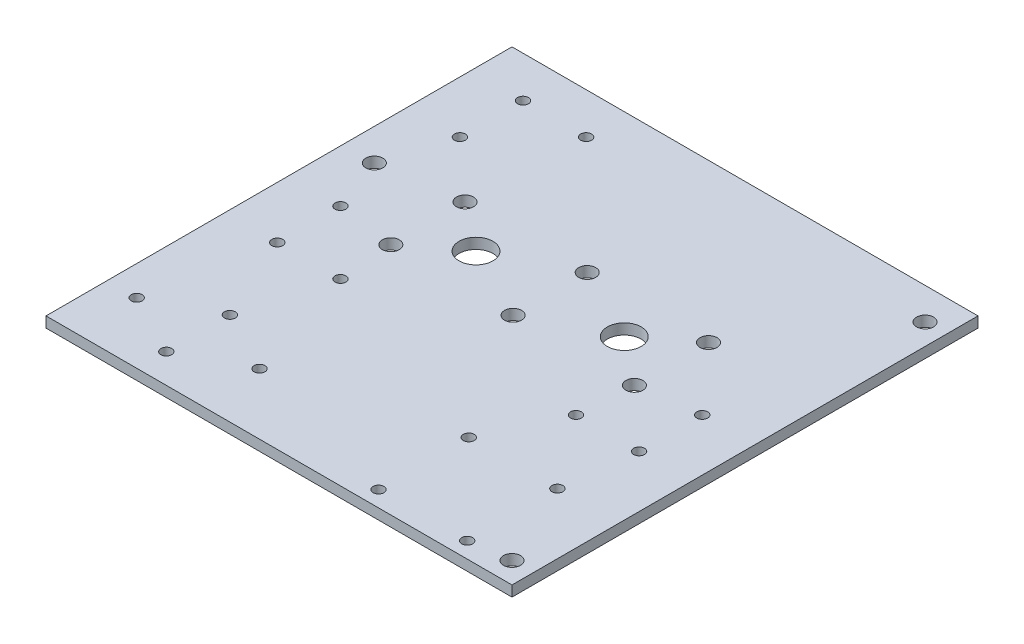
from build123d import *

# Parameters (mm, degrees)
SKETCH1_W                                     = 139.7
SKETCH1_H                                     = 139.7
PLATE_DEPTH                                   = 3.175
SKETCH2_R                                     = 5.08
FORCE_SENSOR_POST_HOLES_DEPTH                 = 99.833828343
GUIDANCE_SCREW_HOLES_10_CLEARANCE_D           = 5.1054
GEARBOX_MOUNT_HOLES_4_CLEARANCE_D             = 3.2639
GEARBOX_MOUNT_HOLES_4_CLEARANCE_DEPTH         = 7.62
GEARBOX_MOUNT_HOLES_4_CLEARANCE_TIP           = 0.980574487
BEARING_MOUNT_HOLES_4_CLEARANCE_D             = 3.2639
BEARING_MOUNT_HOLES_4_CLEARANCE_DEPTH         = 7.62
BEARING_MOUNT_HOLES_4_CLEARANCE_TIP           = 0.980574487
FORCE_SENSOR_FOUNDATION_HOLES_10_CLEARA_D     = 5.1054
FORCE_SENSOR_FOUNDATION_HOLES_10_CLEARA_DEPTH = 7.62
FORCE_SENSOR_FOUNDATION_HOLES_10_CLEARA_TIP   = 1.533816902
BALL_CASTER_MOUNT_HOLES_4_CLEARANCE_D         = 3.2639
BALL_CASTER_MOUNT_HOLES_4_CLEARANCE_DEPTH     = 7.62
BALL_CASTER_MOUNT_HOLES_4_CLEARANCE_TIP       = 0.980574487


with BuildPart() as part:
    # Sketch1 → Plate (new body)
    with BuildSketch(Plane(origin=(0, 0, 0), x_dir=(1, 0, 0), z_dir=(0, 1, 0))):
        Rectangle(SKETCH1_W, SKETCH1_H)
    extrude(amount=PLATE_DEPTH)

    # Sketch2 → Force Sensor Post Holes (cut, through all)
    with BuildSketch(Plane(origin=(0, 3.175, 0), x_dir=(1, 0, 0), z_dir=(0, 1, 0))):
        with Locations(Location((-22.225, 11.43, 0), (0, 0, 270))):
            Circle(SKETCH2_R)
        with Locations(Location((22.225, 11.43, 0), (0, 0, 270))):
            Circle(SKETCH2_R)
    extrude(amount=-FORCE_SENSOR_POST_HOLES_DEPTH, mode=Mode.SUBTRACT)

    # Guidance Screw Holes (#10 clearance) (through all)
    with Locations(Plane(origin=(0, 3.175, 0), x_dir=(1, 0, 0), z_dir=(0, 1, 0))):
        with Locations((63.5, -63.5), (-60.325, 19.05), (63.5, 60.325)):
            Hole(GUIDANCE_SCREW_HOLES_10_CLEARANCE_D / 2)

    # Gearbox Mount Holes (#4 clearance)
    with Locations(Plane(origin=(0, 3.175, 0), x_dir=(1, 0, 0), z_dir=(0, 1, 0))):
        with Locations((-60.96, -51.562), (-42.545, -42.037), (-24.13, -51.562), (-42.545, -61.087)):
            Hole(GEARBOX_MOUNT_HOLES_4_CLEARANCE_D / 2, depth=GEARBOX_MOUNT_HOLES_4_CLEARANCE_DEPTH)
            with Locations((0, 0, -(GEARBOX_MOUNT_HOLES_4_CLEARANCE_DEPTH + GEARBOX_MOUNT_HOLES_4_CLEARANCE_TIP / 2))):  # 118° drill point
                Cone(0, GEARBOX_MOUNT_HOLES_4_CLEARANCE_D / 2, GEARBOX_MOUNT_HOLES_4_CLEARANCE_TIP, mode=Mode.SUBTRACT)

    # Bearing Mount Holes (#4 clearance)
    with Locations(Plane(origin=(0, 3.175, 0), x_dir=(1, 0, 0), z_dir=(0, 1, 0))):
        with Locations((25.0825, -38.0365), (51.6509, -38.0365), (25.0825, -65.0875), (51.6509, -65.0875)):
            Hole(BEARING_MOUNT_HOLES_4_CLEARANCE_D / 2, depth=BEARING_MOUNT_HOLES_4_CLEARANCE_DEPTH)
            with Locations((0, 0, -(BEARING_MOUNT_HOLES_4_CLEARANCE_DEPTH + BEARING_MOUNT_HOLES_4_CLEARANCE_TIP / 2))):  # 118° drill point
                Cone(0, BEARING_MOUNT_HOLES_4_CLEARANCE_D / 2, BEARING_MOUNT_HOLES_4_CLEARANCE_TIP, mode=Mode.SUBTRACT)

    # Force Sensor Foundation Holes (#10 clearance)
    with Locations(Plane(origin=(0, 3.175, 0), x_dir=(1, 0, 0), z_dir=(0, 1, 0))):
        with Locations((-36.6395, 22.5425), (36.3855, 22.5425), (36.3855, 0.3175), (-36.6395, 0.3175), (0, 0.3175), (0, 22.5425)):
            Hole(FORCE_SENSOR_FOUNDATION_HOLES_10_CLEARA_D / 2, depth=FORCE_SENSOR_FOUNDATION_HOLES_10_CLEARA_DEPTH)
            with Locations((0, 0, -(FORCE_SENSOR_FOUNDATION_HOLES_10_CLEARA_DEPTH + FORCE_SENSOR_FOUNDATION_HOLES_10_CLEARA_TIP / 2))):  # 118° drill point
                Cone(0, FORCE_SENSOR_FOUNDATION_HOLES_10_CLEARA_D / 2, FORCE_SENSOR_FOUNDATION_HOLES_10_CLEARA_TIP, mode=Mode.SUBTRACT)

    # Ball Caster Mount Holes (#4 clearance)
    with Locations(Plane(origin=(0, 3.175, 0), x_dir=(1, 0, 0), z_dir=(0, 1, 0))):
        with Locations((-35.306, 57.531), (-54.229, 57.531), (-54.229, 38.608), (-54.229, 2.794), (-54.229, -16.129), (-35.306, -16.129), (35.306, -16.129), (54.229, -16.129), (54.229, 2.794)):
            Hole(BALL_CASTER_MOUNT_HOLES_4_CLEARANCE_D / 2, depth=BALL_CASTER_MOUNT_HOLES_4_CLEARANCE_DEPTH)
            with Locations((0, 0, -(BALL_CASTER_MOUNT_HOLES_4_CLEARANCE_DEPTH + BALL_CASTER_MOUNT_HOLES_4_CLEARANCE_TIP / 2))):  # 118° drill point
                Cone(0, BALL_CASTER_MOUNT_HOLES_4_CLEARANCE_D / 2, BALL_CASTER_MOUNT_HOLES_4_CLEARANCE_TIP, mode=Mode.SUBTRACT)


solid = part.part
